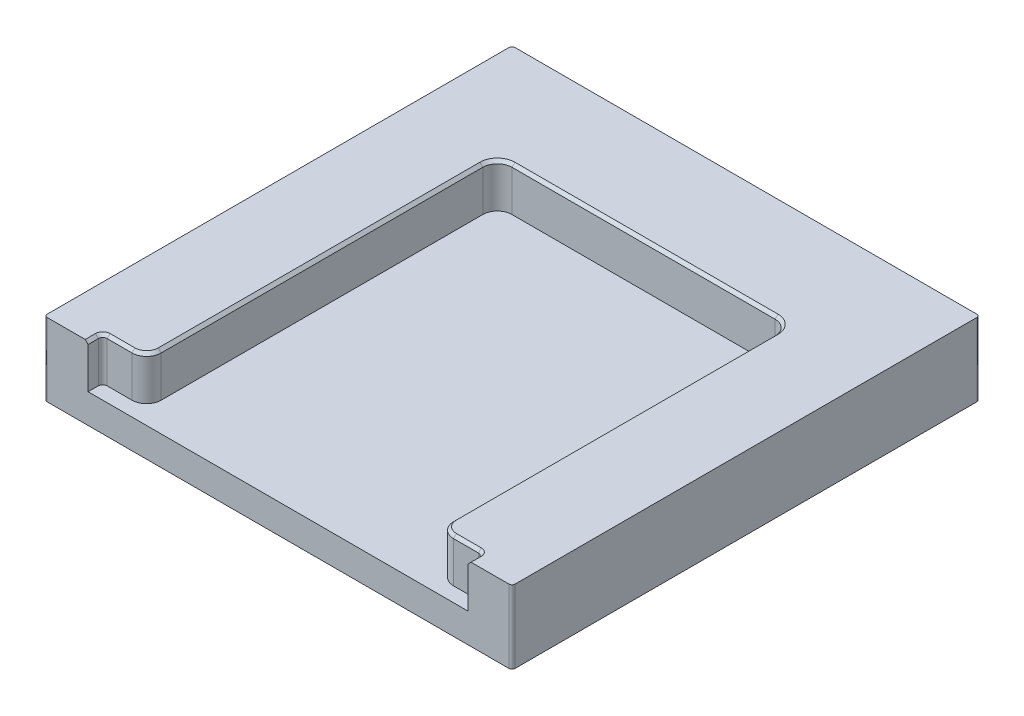
from build123d import *

# Parameters (mm, degrees)
EXTRUDE_1_DEPTH     = 50
CUT_EXTRUDE_2_DEPTH = 30
CHAMFER_1_SIZE      = 2


with BuildPart() as part:
    # 草图1 → 凸台-拉伸1 (new body)
    with BuildSketch(Plane(origin=(0, 0, 0), x_dir=(1, 0, 0), z_dir=(0, 1, 0))):
        with BuildLine():
            Line((-158, -160), (158, -160))
            ThreePointArc((158, -160), (159.414213562, -159.414213562), (160, -158))
            Line((160, -158), (160, 158))
            ThreePointArc((160, 158), (159.414213562, 159.414213562), (158, 160))
            Line((158, 160), (-158, 160))
            ThreePointArc((-158, 160), (-159.414213562, 159.414213562), (-160, 158))
            Line((-160, 158), (-160, -158))
            ThreePointArc((-160, -158), (-159.414213562, -159.414213562), (-158, -160))
        make_face()
    extrude(amount=-EXTRUDE_1_DEPTH)

    # 草图2 → 切除-拉伸2 (cut)
    with BuildSketch(Plane(origin=(0, 0, 0), x_dir=(1, 0, 0), z_dir=(0, 1, 0))):
        with BuildLine():
            Line((130, -153), (130, -160))
            Line((130, -160), (-130, -160))
            Line((-130, -160), (-130, -153))
            ThreePointArc((-130, -153), (-129.121320344, -150.878679656), (-127, -150))
            Line((-127, -150), (-110, -150))
            ThreePointArc((-110, -150), (-102.928932188, -147.071067812), (-100, -140))
            Line((-100, -140), (-100, 80))
            ThreePointArc((-100, 80), (-97.071067812, 87.071067812), (-90, 90))
            Line((-90, 90), (90, 90))
            ThreePointArc((90, 90), (97.071067812, 87.071067812), (100, 80))
            Line((100, 80), (100, -140))
            ThreePointArc((100, -140), (102.928932188, -147.071067812), (110, -150))
            Line((110, -150), (127, -150))
            ThreePointArc((127, -150), (129.121320344, -150.878679656), (130, -153))
        make_face()
    extrude(amount=-CUT_EXTRUDE_2_DEPTH, mode=Mode.SUBTRACT)

    # 倒角1
    chamfer_1_edges = [part.edges().sort_by_distance(p)[0] for p in [
        (130, 0, 156.5),
        (129.121320344, 0, 150.878679656),
        (118.5, 0, 150),
        (102.928932188, 0, 147.071067812),
        (100, 0, 30),
        (97.071067812, 0, -87.071067812),
        (0, 0, -90),
        (-97.071067812, 0, -87.071067812),
        (-100, 0, 30),
        (-102.928932188, 0, 147.071067812),
        (-118.5, 0, 150),
        (-129.121320344, 0, 150.878679656),
        (-130, 0, 156.5),
    ]]
    chamfer(chamfer_1_edges, length=CHAMFER_1_SIZE)


solid = part.part
